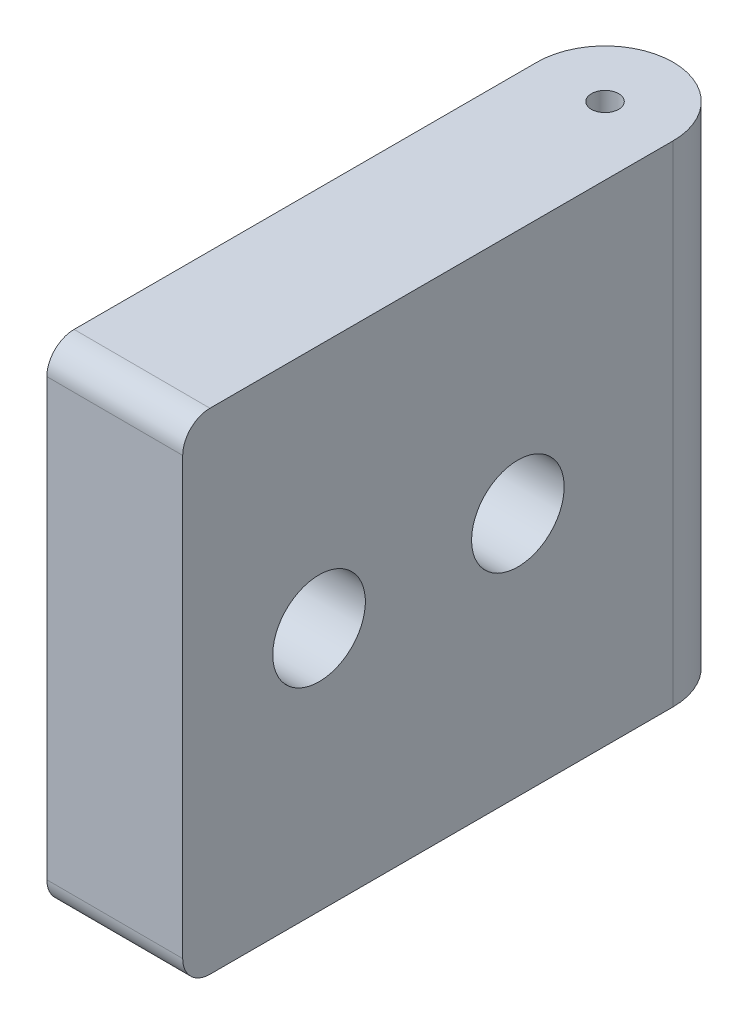
from build123d import *

# Parameters (mm, degrees)
SKETCH1_R                                       = 0.5
BOSS_EXTRUDE1_DEPTH                             = 18
FILLET2_R                                       = 1
CSK_FOR_M3_FLAT_HEAD_MACHINE_SCREW2_D           = 3.4
CSK_FOR_M3_FLAT_HEAD_MACHINE_SCREW2_CSINK_D     = 6.3
CSK_FOR_M3_FLAT_HEAD_MACHINE_SCREW2_CSINK_ANGLE = 90


with BuildPart() as part:
    # Sketch1 → Boss-Extrude1 (new body)
    with BuildSketch(Plane(origin=(0, 0, 0), x_dir=(1, 0, 0), z_dir=(0, 1, 0))):
        with BuildLine():
            Line((-2.5, -17.994062369), (-2.5, 0))
            ThreePointArc((-2.5, 0), (0, 2.5), (2.5, 0))
            Line((2.5, 0), (2.5, -18.006040941))
            Line((2.5, -18.006040941), (-2.5, -17.994062369))
        make_face()
        with Locations(Location((0, 0, 0), (0, 0, 270))):
            Circle(SKETCH1_R, mode=Mode.SUBTRACT)
    extrude(amount=BOSS_EXTRUDE1_DEPTH)

    # Fillet2
    fillet2_edges = [part.edges().sort_by_distance(p)[0] for p in [
        (0, 18, 18.000051655),
        (0, 0, 18.000051655),
    ]]
    fillet(fillet2_edges, radius=FILLET2_R)

    # CSK for M3 Flat Head Machine Screw2 (through all)
    with Locations(Plane.ZY.offset(2.5)):
        with Locations((5.7, 9), (13, 9)):
            CounterSinkHole(CSK_FOR_M3_FLAT_HEAD_MACHINE_SCREW2_D / 2, CSK_FOR_M3_FLAT_HEAD_MACHINE_SCREW2_CSINK_D / 2, counter_sink_angle=CSK_FOR_M3_FLAT_HEAD_MACHINE_SCREW2_CSINK_ANGLE)


solid = part.part
